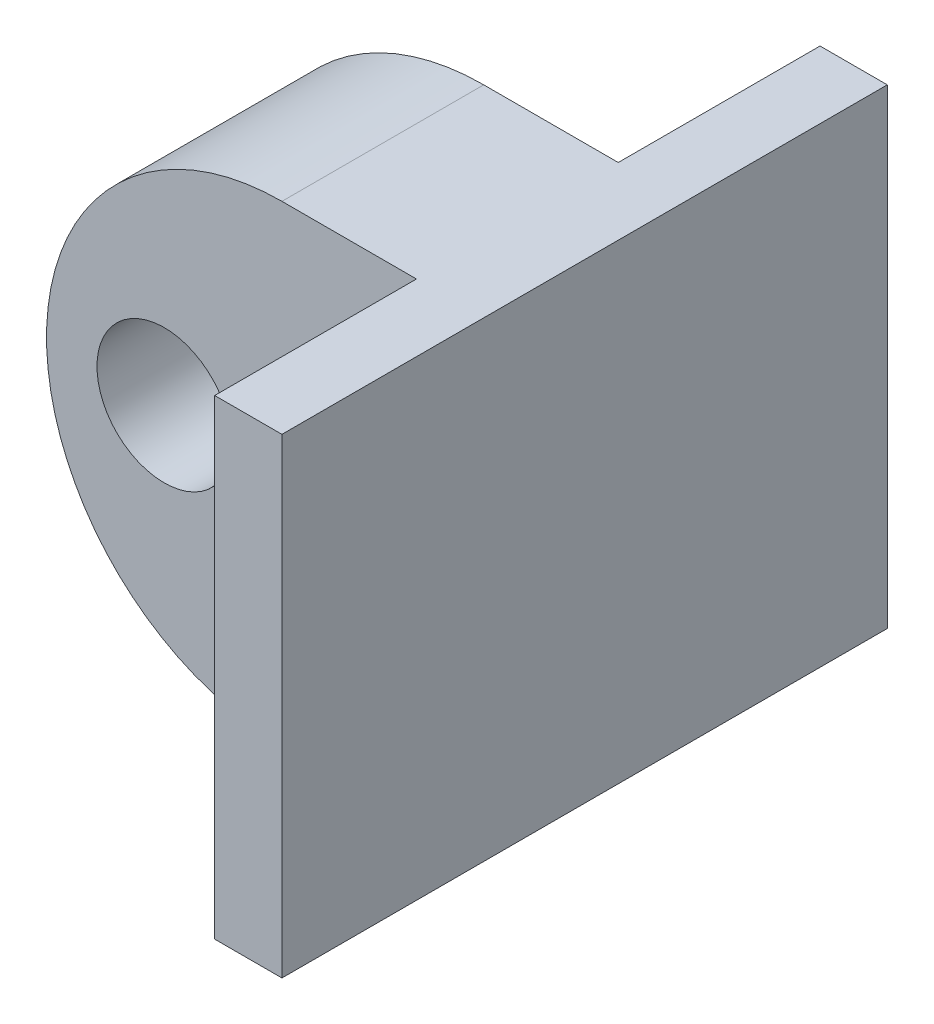
from build123d import *

# Parameters (mm, degrees)
SKETCH1_R           = 10
BOSS_EXTRUDE1_DEPTH = 30
SKETCH2_W           = 90
SKETCH2_H           = 70
BOSS_EXTRUDE2_DEPTH = 10


with BuildPart() as part:
    # Sketch1 → Boss-Extrude1 (new body)
    with BuildSketch(Plane.XY):
        with BuildLine():
            Line((0, 35), (20, 35))
            Line((20, 35), (20, -35))
            Line((20, -35), (0, -35))
            ThreePointArc((0, -35), (-35, 0), (0, 35))
        make_face()
        with Locations((-17.5, 0)):
            Circle(SKETCH1_R, mode=Mode.SUBTRACT)
    extrude(amount=BOSS_EXTRUDE1_DEPTH)

    # Sketch2 → Boss-Extrude2 (add)
    with BuildSketch(Plane(origin=(20, 0, 0), x_dir=(0, 0, -1), z_dir=(1, 0, 0))):
        with Locations((-15, 0)):
            Rectangle(SKETCH2_W, SKETCH2_H)
    extrude(amount=BOSS_EXTRUDE2_DEPTH)


solid = part.part
